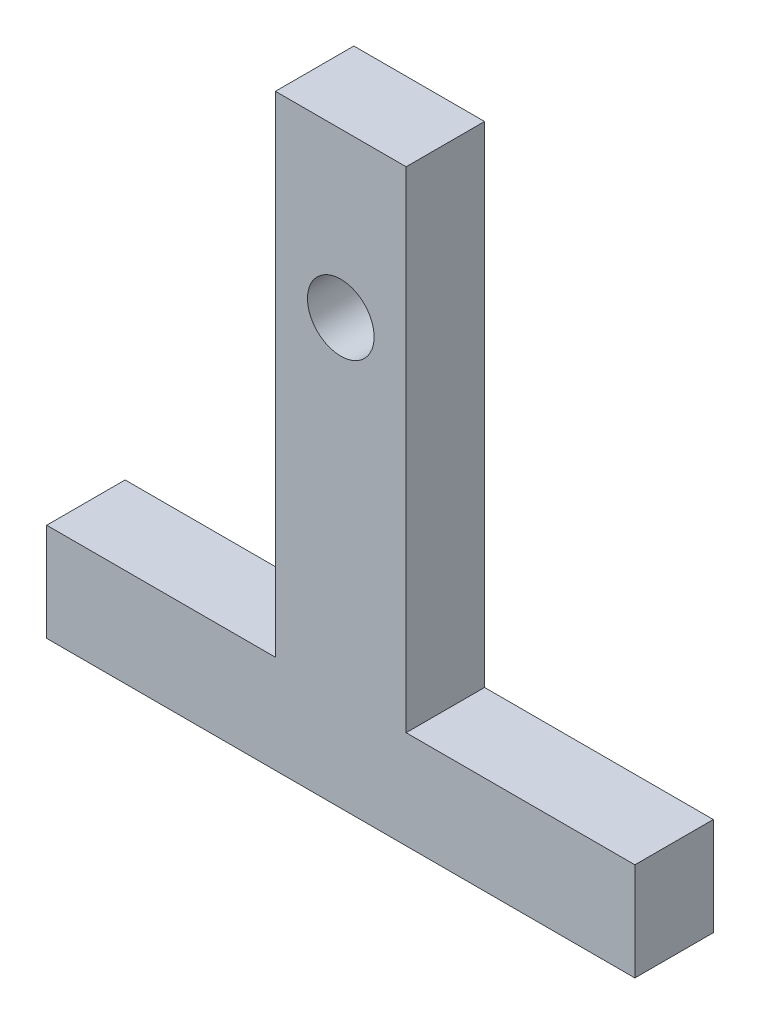
from build123d import *

# Parameters (mm, degrees)
SKETCH_1_R      = 5.1
EXTRUDE_1_DEPTH = 12


with BuildPart() as part:
    # 草图1 → 凸台-拉伸1 (new body)
    with BuildSketch(Plane.XY):
        Polygon((-45, 0), (45, 0), (45, 15), (10, 15), (10, 90), (-10, 90), (-10, 15), (-45, 15), align=None)
        with Locations((0, 65)):
            Circle(SKETCH_1_R, mode=Mode.SUBTRACT)
    extrude(amount=EXTRUDE_1_DEPTH)


solid = part.part
